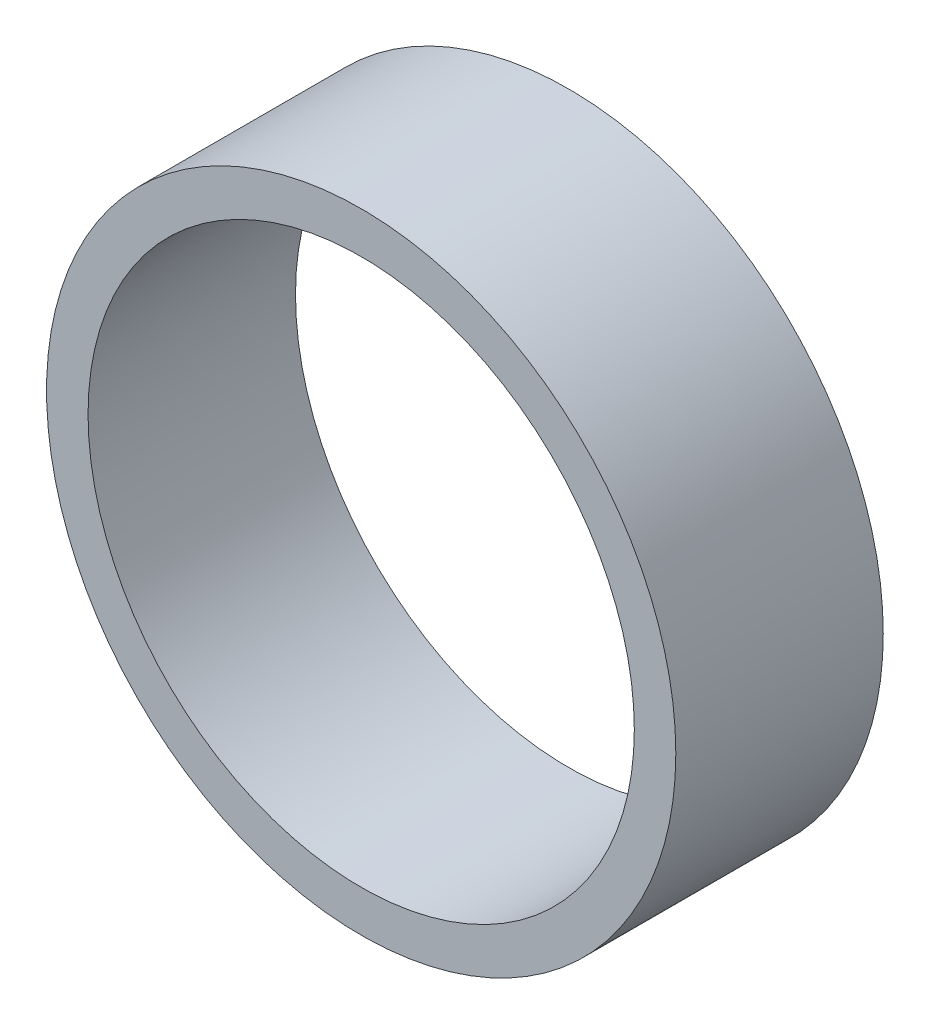
from build123d import *

# Parameters (mm, degrees)
SKETCH1_R           = 22.75
BOSS_EXTRUDE1_DEPTH = 15
SKETCH2_R           = 19.75
CUT_EXTRUDE1_DEPTH  = 36.498239393


with BuildPart() as part:
    # Sketch1 → Boss-Extrude1 (new body)
    with BuildSketch(Plane.XY):
        Circle(SKETCH1_R)
    extrude(amount=BOSS_EXTRUDE1_DEPTH)

    # Sketch2 → Cut-Extrude1 (cut, through all)
    with BuildSketch(Plane.XY.offset(15)):
        Circle(SKETCH2_R)
    extrude(amount=-CUT_EXTRUDE1_DEPTH, mode=Mode.SUBTRACT)


solid = part.part
